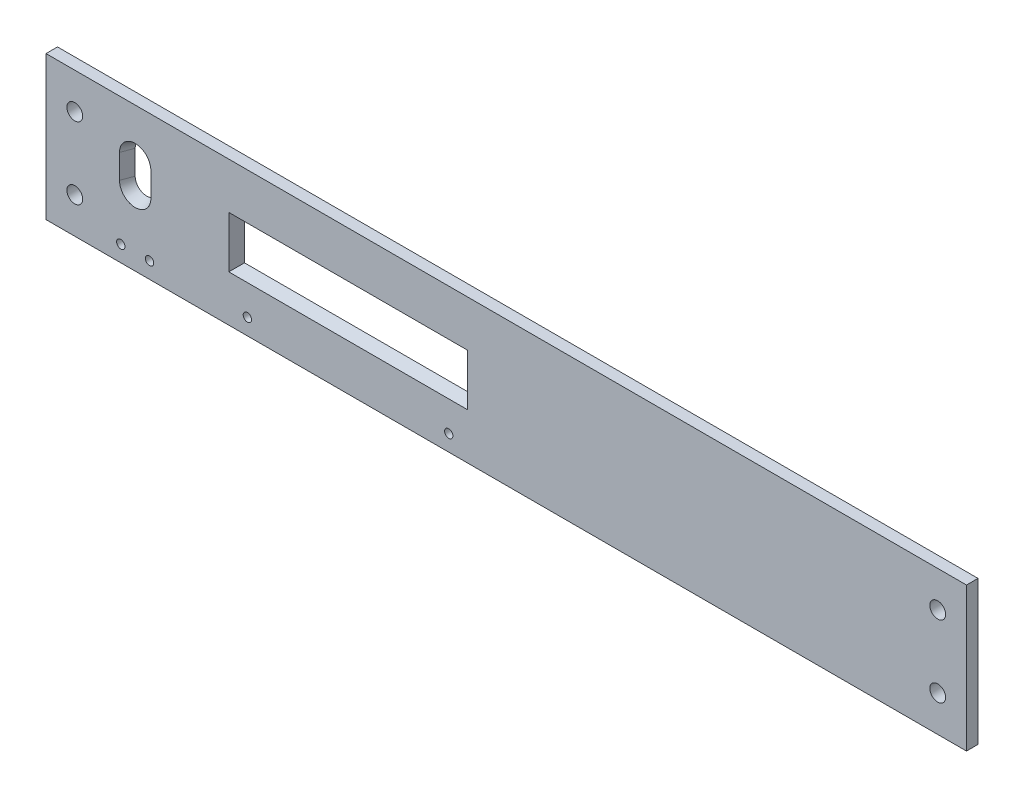
from build123d import *

# Parameters (mm, degrees)
SKETCH1_W                     = 320
SKETCH1_H                     = 50
BOSS_EXTRUDE1_DEPTH           = 4
M5_CLEARANCE_HOLE1_AT_2_COUNT = 2
M5_CLEARANCE_HOLE1_AT_2_PITCH = 300
LPATTERN1_COUNT               = 2
LPATTERN1_PITCH               = 25
SKETCH5_W                     = 80
SKETCH5_H                     = 15
CUT_EXTRUDE1_DEPTH            = 324.907394173
CUT_EXTRUDE3_DEPTH            = 324.907394173
M2_5_CLEARANCE_HOLE1_D        = 2.9
M2_5_CLEARANCE_HOLE1_DEPTH    = 14
M2_5_CLEARANCE_HOLE1_TIP      = 0.871247898
DRAFT1_ANGLE                  = -20


with BuildPart() as part:
    # Sketch1 → Boss-Extrude1 (new body)
    with BuildSketch(Plane.XY):
        with Locations((160, 25)):
            Rectangle(SKETCH1_W, SKETCH1_H)
    extrude(amount=BOSS_EXTRUDE1_DEPTH)

    # Sketch4 → M5 Clearance Hole1 (revolve, cut)
    with BuildSketch(Plane(origin=(310, 37.5, 4), x_dir=(0, -1, 0), z_dir=(1, 0, 0))):
        Polygon((0, 0), (0, 15.652366702), (2.75, 14), (2.75, 0), align=None)
    m5_clearance_hole1 = revolve(axis=Axis((310, 37.5, 10.35), (0, 0, -1)), mode=Mode.SUBTRACT)

    # M5 Clearance Hole1 at 2: M5 Clearance Hole1 ×2
    with Locations(*[(-i * M5_CLEARANCE_HOLE1_AT_2_PITCH, 0, 0) for i in range(1, M5_CLEARANCE_HOLE1_AT_2_COUNT)]):
        add(m5_clearance_hole1, mode=Mode.SUBTRACT)

    # LPattern1: M5 Clearance Hole1 ×2
    with Locations(*[(0, -i * LPATTERN1_PITCH, 0) for i in range(1, LPATTERN1_COUNT)]):
        add(m5_clearance_hole1, mode=Mode.SUBTRACT)

    # LPattern1 copy 1 sketch → LPattern1 copy 1 (revolve, cut)
    with BuildSketch(Plane(origin=(10, 12.5, 4), x_dir=(0, -1, 0), z_dir=(1, 0, 0))):
        Polygon((0, 0), (0, 15.652366702), (2.75, 14), (2.75, 0), align=None)
    revolve(axis=Axis((10, 12.5, 10.35), (0, 0, -1)), mode=Mode.SUBTRACT)

    # Sketch5 → Cut-Extrude1 (cut, through all)
    with BuildSketch(Plane.XY.offset(4)):
        with Locations((105, 25)):
            Rectangle(SKETCH5_W, SKETCH5_H)
    extrude(amount=-CUT_EXTRUDE1_DEPTH, mode=Mode.SUBTRACT)

    # Sketch6 → Cut-Extrude3 (cut, through all)
    with BuildSketch(Plane.XY.offset(4)):
        with BuildLine():
            Line((27, 24.6), (27, 33))
            ThreePointArc((27, 33), (31, 37), (35, 33))
            Line((35, 33), (35, 24.6))
            ThreePointArc((35, 24.6), (31, 20.6), (27, 24.6))
        make_face()
    extrude(amount=-CUT_EXTRUDE3_DEPTH, mode=Mode.SUBTRACT)

    # M2.5 Clearance Hole1
    with Locations(Plane.XY.offset(4)):
        with Locations((140, 5.6), (26, 5.6), (36, 5.6), (70, 5.6)):
            Hole(M2_5_CLEARANCE_HOLE1_D / 2, depth=M2_5_CLEARANCE_HOLE1_DEPTH)
            with Locations((0, 0, -(M2_5_CLEARANCE_HOLE1_DEPTH + M2_5_CLEARANCE_HOLE1_TIP / 2))):  # 118° drill point
                Cone(0, M2_5_CLEARANCE_HOLE1_D / 2, M2_5_CLEARANCE_HOLE1_TIP, mode=Mode.SUBTRACT)

    # Draft1
    draft1_faces = [part.faces().sort_by_distance(p)[0] for p in [
        (145, 25, 2),
        (105, 32.5, 2),
        (65, 25, 2),
        (105, 17.5, 2),
        (35, 28.8, 2),
        (31, 37, 2),
        (27, 28.8, 2),
        (31, 20.6, 2),
    ]]
    draft(draft1_faces, Plane(origin=(0, 0, 0), x_dir=(-1, 0, 0), z_dir=(0, 0, -1)), DRAFT1_ANGLE)


solid = part.part
